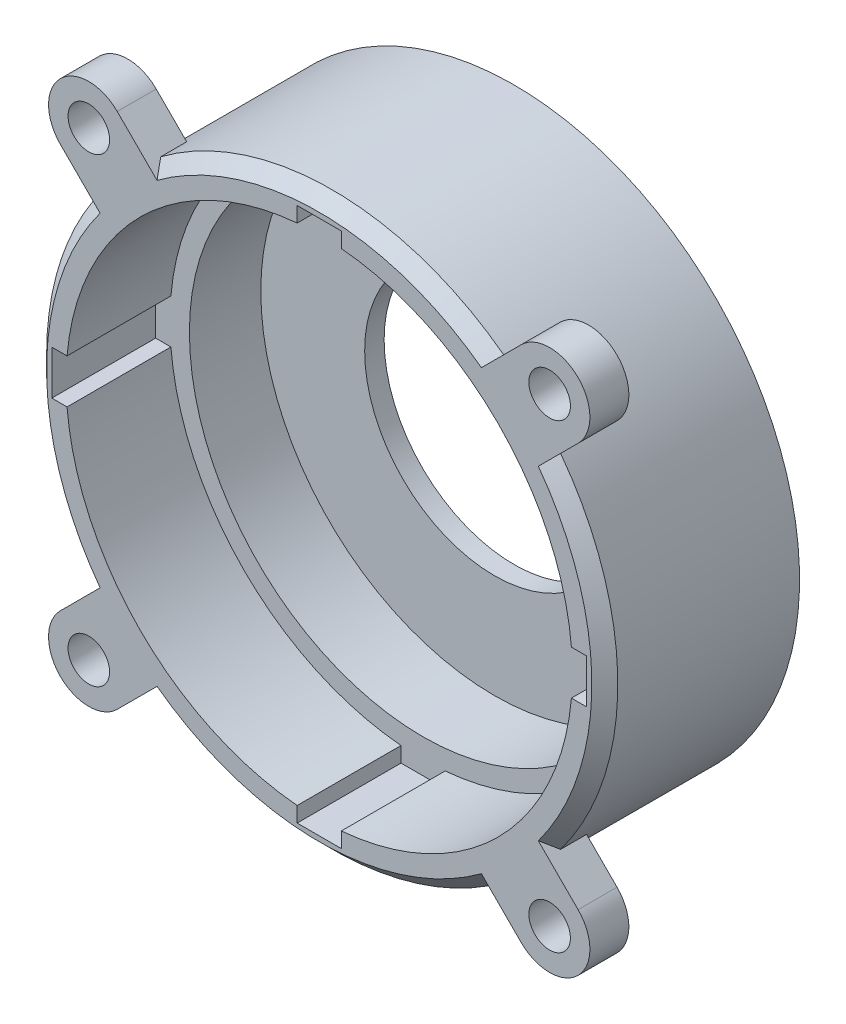
from build123d import *

# Parameters (mm, degrees)
SKETCH1_R               = 22
BOSS_EXTRUDE1_DEPTH     = 8.25
SKETCH2_R               = 18
CUT_EXTRUDE1_DEPTH      = 13.5
SKETCH3_R               = 19.5
CUT_EXTRUDE2_DEPTH      = 8
CUT_EXTRUDE3_DEPTH      = 36.217183306
CUT_EXTRUDE3_DEPTH_BACK = 36.217183306
SKETCH4_R               = 10
SKETCH6_W               = 3.4
SKETCH6_H               = 2.2
CUT_EXTRUDE5_DEPTH      = 8
CIRPATTERN1_COUNT       = 4
CUT_EXTRUDE6_START      = -1.5
SKETCH7_R               = 22
CUT_EXTRUDE6_DEPTH      = 1.5
CHAMFER1_SIZE           = 1
SKETCH8_R               = 1.6
BOSS_EXTRUDE2_DEPTH     = 3
CIRPATTERN2_COUNT       = 4


with BuildPart() as part:
    # Sketch1 → Boss-Extrude1 (new, symmetric)
    with BuildSketch(Plane.XY):
        Circle(SKETCH1_R)
    extrude(amount=BOSS_EXTRUDE1_DEPTH, both=True)

    # Sketch2 → Cut-Extrude1 (cut)
    with BuildSketch(Plane.XY.offset(8.25)):
        Circle(SKETCH2_R)
    extrude(amount=-CUT_EXTRUDE1_DEPTH, mode=Mode.SUBTRACT)

    # Sketch3 → Cut-Extrude2 (cut)
    with BuildSketch(Plane.XY.offset(8.25)):
        Circle(SKETCH3_R)
    extrude(amount=-CUT_EXTRUDE2_DEPTH, mode=Mode.SUBTRACT)

    # Sketch4 → Cut-Extrude3 (cut, two sides: drawn at the far end of the back side and taken through both)
    with BuildSketch(Plane(origin=(0, 0, -8.25), x_dir=(-1, 0, 0), z_dir=(0, 0, -1)).offset(-CUT_EXTRUDE3_DEPTH_BACK)):
        with Locations(Location((0, 0, 0), (0, 0, 180))):
            Circle(SKETCH4_R)
    extrude(amount=CUT_EXTRUDE3_DEPTH + CUT_EXTRUDE3_DEPTH_BACK, mode=Mode.SUBTRACT)

    # Sketch6 → Cut-Extrude5 (cut)
    with BuildSketch(Plane.XY.offset(8.25)):
        with Locations((0, 19.5)):
            Rectangle(SKETCH6_W, SKETCH6_H)
    cut_extrude5 = extrude(amount=-CUT_EXTRUDE5_DEPTH, mode=Mode.SUBTRACT)

    # CirPattern1: Cut-Extrude5 ×4 about axis
    cirpattern1_axis = Axis((0, 0, 0), (0, 0, 1))
    for i in range(1, CIRPATTERN1_COUNT):
        add(cut_extrude5.rotate(cirpattern1_axis, i * 360 / CIRPATTERN1_COUNT), mode=Mode.SUBTRACT)

    # Sketch7 → Cut-Extrude6 (cut)
    with BuildSketch(Plane(origin=(0, 0, -8.25), x_dir=(-1, 0, 0), z_dir=(0, 0, -1)).offset(CUT_EXTRUDE6_START)):
        Circle(SKETCH7_R)
    extrude(amount=CUT_EXTRUDE6_DEPTH, mode=Mode.SUBTRACT)

    # Chamfer1
    chamfer1_edges = [part.edges().sort_by_distance(p)[0] for p in [
        (-22, 0, 8.25),
    ]]
    chamfer(chamfer1_edges, length=CHAMFER1_SIZE)

    # Sketch8 → Boss-Extrude2 (add)
    with BuildSketch(Plane.XY.offset(8.25)):
        with BuildLine():
            Line((15.556349186, 19.940411229), (12.494527459, 16.878589502))
            Line((12.494527459, 16.878589502), (16.878589502, 12.494527459))
            Line((16.878589502, 12.494527459), (19.940411229, 15.556349186))
            ThreePointArc((19.940411229, 15.556349186), (19.940411229, 19.940411229), (15.556349186, 19.940411229))
        make_face()
        with Locations((17.748380208, 17.748380208)):
            Circle(SKETCH8_R, mode=Mode.SUBTRACT)
    boss_extrude2 = extrude(amount=-BOSS_EXTRUDE2_DEPTH)

    # CirPattern2: Boss-Extrude2 ×4 about axis
    cirpattern2_axis = Axis((0, 0, 0), (0, 0, 1))
    for i in range(1, CIRPATTERN2_COUNT):
        add(boss_extrude2.rotate(cirpattern2_axis, i * 360 / CIRPATTERN2_COUNT))


solid = part.part
